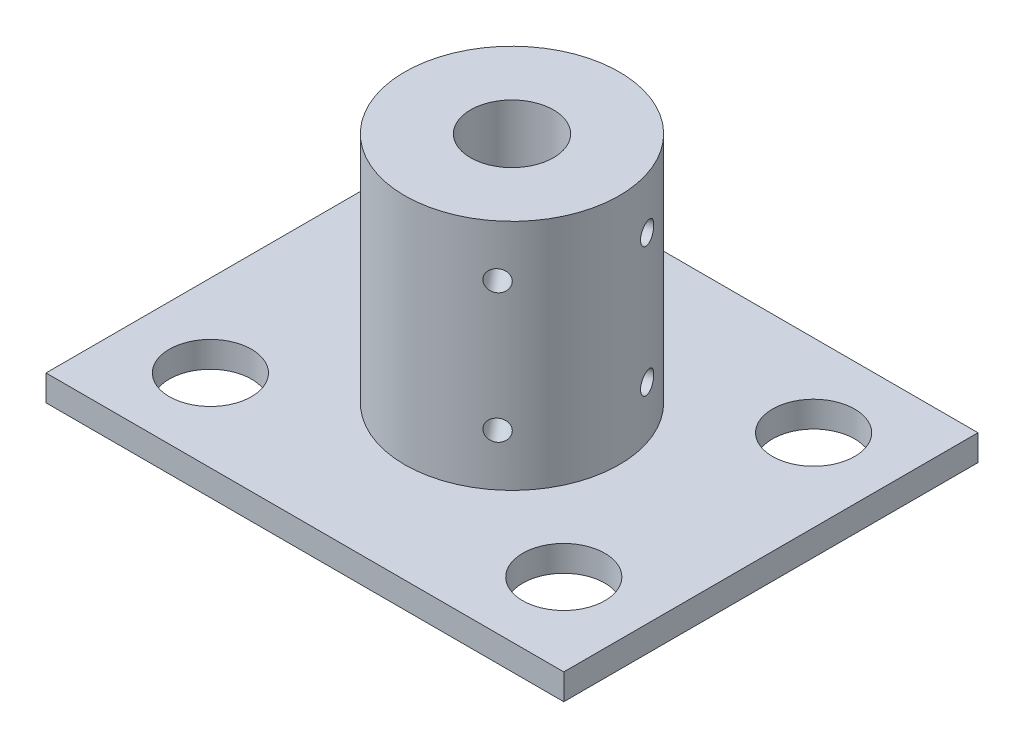
from build123d import *

# Parameters (mm, degrees)
SKETCH1_W           = 100
SKETCH1_H           = 80
BOSS_EXTRUDE1_DEPTH = 5
SKETCH2_R           = 8.0125
CUT_EXTRUDE1_DEPTH  = 129.16005618
BOSS_EXTRUDE2_START = 45
SKETCH3_R           = 20.715
SKETCH3_R_2         = 8.0125
BOSS_EXTRUDE2_DEPTH = 45
SKETCH4_R           = 2.0193
CUT_EXTRUDE2_DEPTH  = 15
SKETCH6_R           = 2.0193
CUT_EXTRUDE3_DEPTH  = 15
SKETCH7_R           = 7.9375
CUT_EXTRUDE4_DEPTH  = 136.738719638


with BuildPart() as part:
    # Sketch1 → Boss-Extrude1 (new body)
    with BuildSketch(Plane(origin=(0, 0, 0), x_dir=(1, 0, 0), z_dir=(0, 1, 0))):
        with Locations((50, -40)):
            Rectangle(SKETCH1_W, SKETCH1_H)
    extrude(amount=BOSS_EXTRUDE1_DEPTH)

    # Sketch2 → Cut-Extrude1 (cut, through all)
    with BuildSketch(Plane(origin=(0, 5, 0), x_dir=(1, 0, 0), z_dir=(0, 1, 0))):
        with Locations((50, -40)):
            Circle(SKETCH2_R)
    extrude(amount=-CUT_EXTRUDE1_DEPTH, mode=Mode.SUBTRACT)

    # Sketch3 → Boss-Extrude2 (add)
    with BuildSketch(Plane(origin=(0, 5, 0), x_dir=(1, 0, 0), z_dir=(0, 1, 0)).offset(BOSS_EXTRUDE2_START)):
        with Locations((50, -40)):
            Circle(SKETCH3_R)
        with Locations((50, -40)):
            Circle(SKETCH3_R_2, mode=Mode.SUBTRACT)
    extrude(amount=-BOSS_EXTRUDE2_DEPTH)

    # Sketch4 → Cut-Extrude2 (cut)
    with BuildSketch(Plane(origin=(63.180969698, 50, 55.980402461), x_dir=(0.7714411036002745, 0, -0.6363007336755088), z_dir=(0.6363007336755088, 0, 0.7714411036002745))):
        with Locations((0, -10)):
            Circle(SKETCH4_R)
        with Locations((0, -35)):
            Circle(SKETCH4_R)
    extrude(amount=-CUT_EXTRUDE2_DEPTH, mode=Mode.SUBTRACT)

    # Sketch6 → Cut-Extrude3 (cut)
    with BuildSketch(Plane(origin=(52.5543225, 0, -17.601285723), x_dir=(0, -1, 0), z_dir=(0.9482321037380778, 0, -0.3175781438330723))):
        with Locations((-40, -53.808191341)):
            Circle(SKETCH6_R)
        with Locations((-15, -53.808191341)):
            Circle(SKETCH6_R)
    extrude(amount=-CUT_EXTRUDE3_DEPTH, mode=Mode.SUBTRACT)

    # Sketch7 → Cut-Extrude4 (cut, through all)
    with BuildSketch(Plane(origin=(0, 5, 0), x_dir=(1, 0, 0), z_dir=(0, 1, 0))):
        with Locations((84.125, -64.125)):
            Circle(SKETCH7_R)
        with Locations((15.875, -64.125)):
            Circle(SKETCH7_R)
        with Locations((15.875, -15.875)):
            Circle(SKETCH7_R)
        with Locations((84.125, -15.875)):
            Circle(SKETCH7_R)
    extrude(amount=-CUT_EXTRUDE4_DEPTH, mode=Mode.SUBTRACT)


solid = part.part
